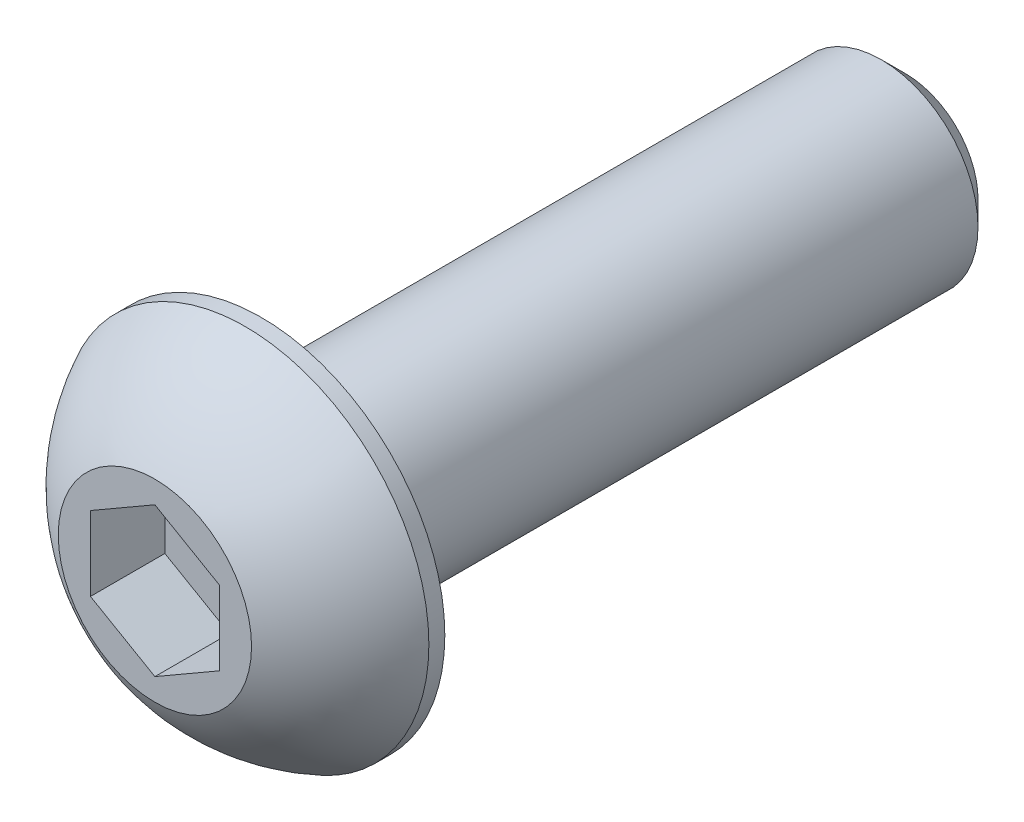
from build123d import *

# Parameters (mm, degrees)
SKETCH1_W          = 10
SKETCH1_H          = 1.5
CHAMFER1_SIZE      = 0.375
CUT_EXTRUDE2_DEPTH = 1.155


with BuildPart() as part:
    # Sketch1 → Revolve1 (revolve)
    with BuildSketch(Plane(origin=(0, 0, 0), x_dir=(0, 0, -1), z_dir=(1, 0, 0))):
        with Locations((6.65, 0.75)):
            Rectangle(SKETCH1_W, SKETCH1_H)
    revolve(axis=Axis((0, 0, -11.65), (0, 0, 1)))

    # Chamfer1
    chamfer1_edges = [part.edges().sort_by_distance(p)[0] for p in [
        (0, -1.5, -11.65),
    ]]
    chamfer(chamfer1_edges, length=CHAMFER1_SIZE)

    # Sketch7 → Revolve2 (revolve)
    with BuildSketch(Plane(origin=(0, 0, 0), x_dir=(0, 0, -1), z_dir=(1, 0, 0))):
        with BuildLine():
            Line((1.4025, 2.85), (1.65, 2.85))
            Line((1.65, 2.85), (1.65, 0))
            Line((1.65, 0), (0, 0))
            Line((0, 0), (0, 1.5))
            ThreePointArc((0, 1.5), (0.59512511, 2.285251969), (1.4025, 2.85))
        make_face()
    revolve(axis=Axis((0, 0, 0), (0, 0, -1)))

    # Sketch5 → Cut-Extrude2 (cut)
    with BuildSketch(Plane.XY):
        Polygon((1, -0.577350269), (1, 0.577350269), (0, 1.154700538), (-1, 0.577350269), (-1, -0.577350269), (0, -1.154700538), align=None)
    extrude(amount=-CUT_EXTRUDE2_DEPTH, mode=Mode.SUBTRACT)


solid = part.part
